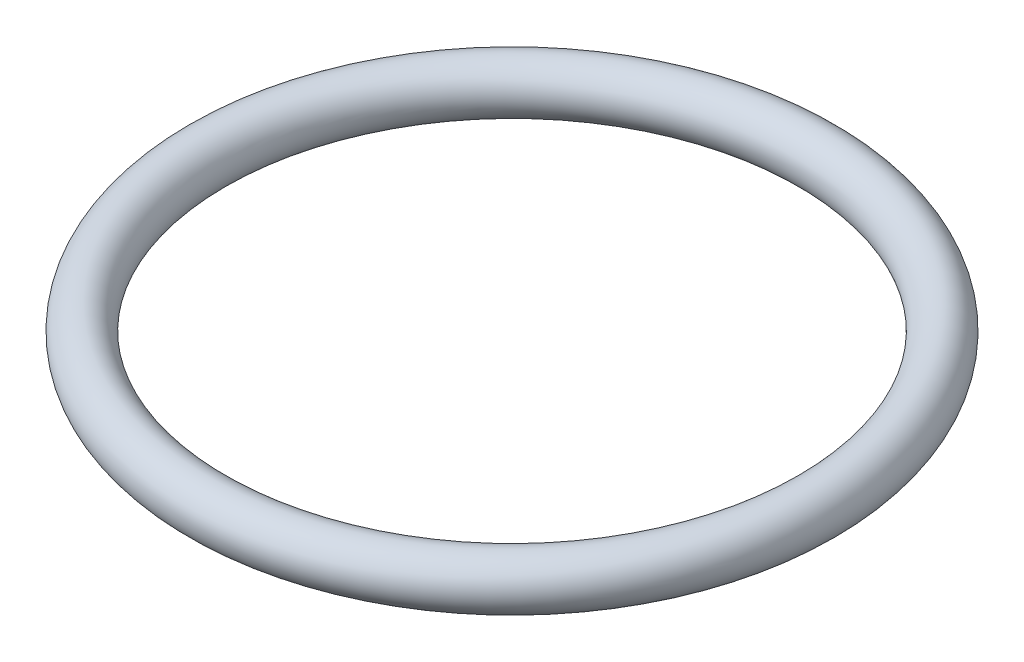
from build123d import *

# Parameters (mm, degrees)
SKETCH_1_R = 5


with BuildPart() as part:
    # Эскиз1 → Повернуть1 (revolve)
    with BuildSketch(Plane.XY, mode=Mode.PRIVATE) as revolve_1_sk:
        with Locations((-60, 0)):
            Circle(SKETCH_1_R)
    revolve(revolve_1_sk.sketch.rotate(Axis((0, -245.208562457, 0), (0, 1, 0)), 180), axis=Axis((0, -245.208562457, 0), (0, 1, 0)))


solid = part.part
